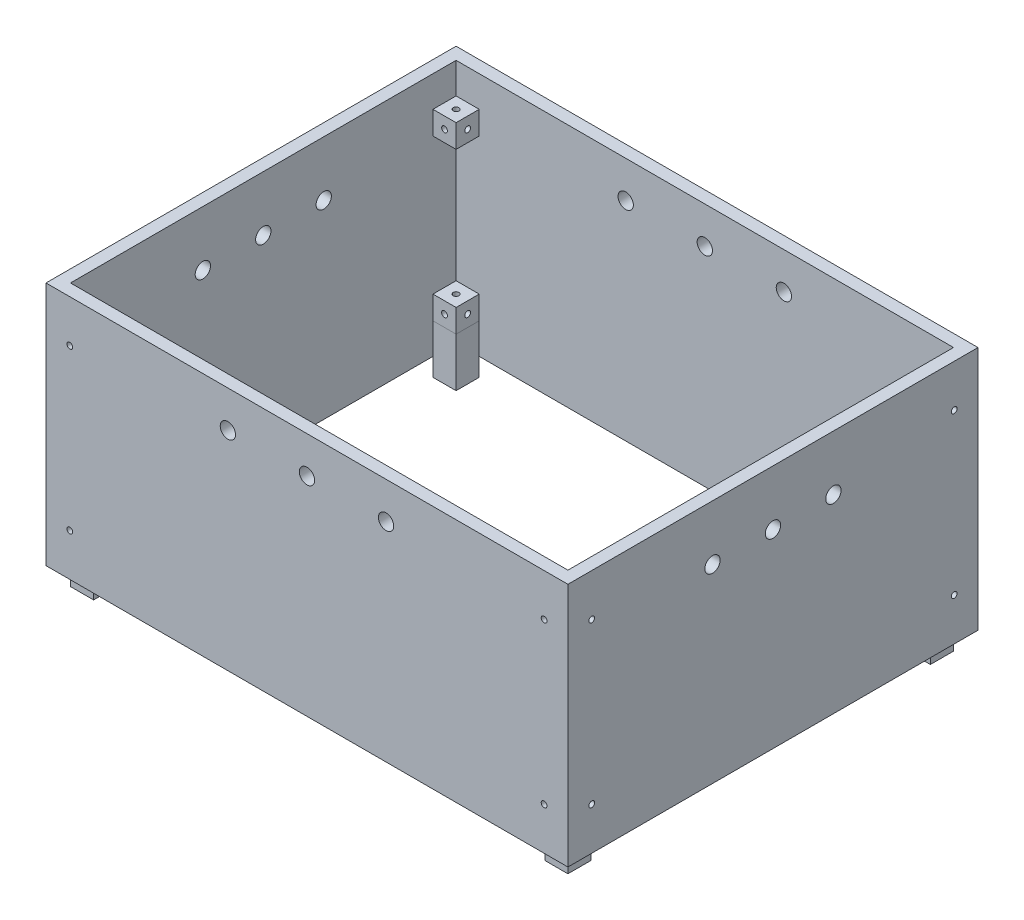
from build123d import *

# Parameters (mm, degrees)
SKETCH1_W            = 270.7
SKETCH1_H            = 212.7
SKETCH1_W_2          = 258
SKETCH1_H_2          = 200
WALLS_DEPTH          = 127
SKETCH2_R            = 3.96875
RODHOLESHEIGHT_DEPTH = 367.945200268
SKETCH4_R            = 3.96875
RODHOLESWIDTH_DEPTH  = 367.945200268
SKETCH3_W            = 12
SKETCH3_H            = 12
MODDINGCUBE_DEPTH    = 12
SKETCH11_R           = 1.5
CUT_EXTRUDE1_DEPTH   = 357.622226593
SKETCH17_R           = 1.5
CUT_EXTRUDE4_DEPTH   = 359.218899557
SKETCH15_R           = 1.5
CUT_EXTRUDE2_DEPTH   = 354.625243019
SKETCH18_W           = 12
SKETCH18_H           = 12
PEGS_DEPTH           = 25.4
PEGS_2_DEPTH         = 25.4
PEGS_3_DEPTH         = 25.4
PEGS_4_DEPTH         = 25.4


with BuildPart() as part:
    # Sketch1 → Walls (new body)
    with BuildSketch(Plane(origin=(0, 0, 0), x_dir=(1, 0, 0), z_dir=(0, 1, 0))):
        with Locations((135.35, 106.35)):
            Rectangle(SKETCH1_W, SKETCH1_H)
        with Locations((135.35, 106.35)):
            Rectangle(SKETCH1_W_2, SKETCH1_H_2, mode=Mode.SUBTRACT)
    extrude(amount=WALLS_DEPTH)

    # Sketch2 → RodHolesHeight (cut, through all)
    with BuildSketch(Plane.XY):
        with Locations((135.35, 107.95)):
            Circle(SKETCH2_R)
        with Locations((94.33, 107.95)):
            Circle(SKETCH2_R)
        with Locations((176.366666667, 107.95)):
            Circle(SKETCH2_R)
    extrude(amount=-RODHOLESHEIGHT_DEPTH, mode=Mode.SUBTRACT)

    # Sketch4 → RodHolesWidth (cut, through all)
    with BuildSketch(Plane.ZY):
        with Locations((-106.35, 98.425)):
            Circle(SKETCH4_R)
        with Locations((-137.7, 98.425)):
            Circle(SKETCH4_R)
        with Locations((-75, 98.425)):
            Circle(SKETCH4_R)
    extrude(amount=-RODHOLESWIDTH_DEPTH, mode=Mode.SUBTRACT)

    # Sketch3 → ModdingCube (add)
    with BuildSketch(Plane(origin=(0, 0, -6.35), x_dir=(-1, 0, 0), z_dir=(0, 0, -1))):
        with Locations((-258.35, 105)):
            Rectangle(SKETCH3_W, SKETCH3_H)
        with Locations((-258.35, 22)):
            Rectangle(SKETCH3_W, SKETCH3_H)
        with Locations((-12.35, 22)):
            Rectangle(SKETCH3_W, SKETCH3_H)
        with Locations((-12.35, 105)):
            Rectangle(SKETCH3_W, SKETCH3_H)
    moddingcube = extrude(amount=MODDINGCUBE_DEPTH)

    # Sketch11 → Cut-Extrude1 (cut, symmetric)
    with BuildSketch(Plane(origin=(0, 0, -18.35), x_dir=(-1, 0, 0), z_dir=(0, 0, -1))):
        with Locations((-258.35, 105)):
            Circle(SKETCH11_R)
        with Locations((-258.35, 22)):
            Circle(SKETCH11_R)
        with Locations((-12.35, 105)):
            Circle(SKETCH11_R)
        with Locations((-12.35, 22)):
            Circle(SKETCH11_R)
    cut_extrude1 = extrude(amount=CUT_EXTRUDE1_DEPTH, both=True, mode=Mode.SUBTRACT)

    # Sketch17 → Cut-Extrude4 (cut, symmetric)
    with BuildSketch(Plane(origin=(0, 28, 0), x_dir=(1, 0, 0), z_dir=(0, 1, 0))):
        with Locations((12.35, 12.35)):
            Circle(SKETCH17_R)
        with Locations(Location((258.35, 12.35, 0), (0, 0, 270))):
            Circle(SKETCH17_R)
    cut_extrude4 = extrude(amount=CUT_EXTRUDE4_DEPTH, both=True, mode=Mode.SUBTRACT)

    # Sketch15 → Cut-Extrude2 (cut, symmetric)
    with BuildSketch(Plane.ZY.offset(-252.35)):
        with Locations(Location((-12.35, 105, 0), (0, 0, 270))):
            Circle(SKETCH15_R)
        with Locations(Location((-12.35, 22, 0), (0, 0, 270))):
            Circle(SKETCH15_R)
    cut_extrude2 = extrude(amount=CUT_EXTRUDE2_DEPTH, both=True, mode=Mode.SUBTRACT)

    # Mirror6: ModdingCube, Cut-Extrude1, Cut-Extrude4, Cut-Extrude2 across plane
    add(moddingcube.mirror(Plane(origin=(0, 0, -106.35), x_dir=(1, 0, 0), z_dir=(0, 0, -1))))
    add(cut_extrude1.mirror(Plane(origin=(0, 0, -106.35), x_dir=(1, 0, 0), z_dir=(0, 0, -1))), mode=Mode.SUBTRACT)
    add(cut_extrude4.mirror(Plane(origin=(0, 0, -106.35), x_dir=(1, 0, 0), z_dir=(0, 0, -1))), mode=Mode.SUBTRACT)
    add(cut_extrude2.mirror(Plane(origin=(0, 0, -106.35), x_dir=(1, 0, 0), z_dir=(0, 0, -1))), mode=Mode.SUBTRACT)


with BuildPart() as body_2:
    # Sketch18 → Pegs (new body)
    with BuildSketch(Plane.XZ.offset(-16)):
        with Locations((12.35, -12.35)):
            Rectangle(SKETCH18_W, SKETCH18_H)
    extrude(amount=PEGS_DEPTH)


with BuildPart() as body_3:
    # Sketch18 → Pegs 2 (new body)
    with BuildSketch(Plane.XZ.offset(-16)):
        with Locations((12.35, -200.35)):
            Rectangle(SKETCH18_W, SKETCH18_H)
    extrude(amount=PEGS_2_DEPTH)


with BuildPart() as body_4:
    # Sketch18 → Pegs 3 (new body)
    with BuildSketch(Plane.XZ.offset(-16)):
        with Locations((258.35, -200.35)):
            Rectangle(SKETCH18_W, SKETCH18_H)
    extrude(amount=PEGS_3_DEPTH)


with BuildPart() as body_5:
    # Sketch18 → Pegs 4 (new body)
    with BuildSketch(Plane.XZ.offset(-16)):
        with Locations((258.35, -12.35)):
            Rectangle(SKETCH18_W, SKETCH18_H)
    extrude(amount=PEGS_4_DEPTH)


solid = Compound([part.part, body_2.part, body_3.part, body_4.part, body_5.part])
